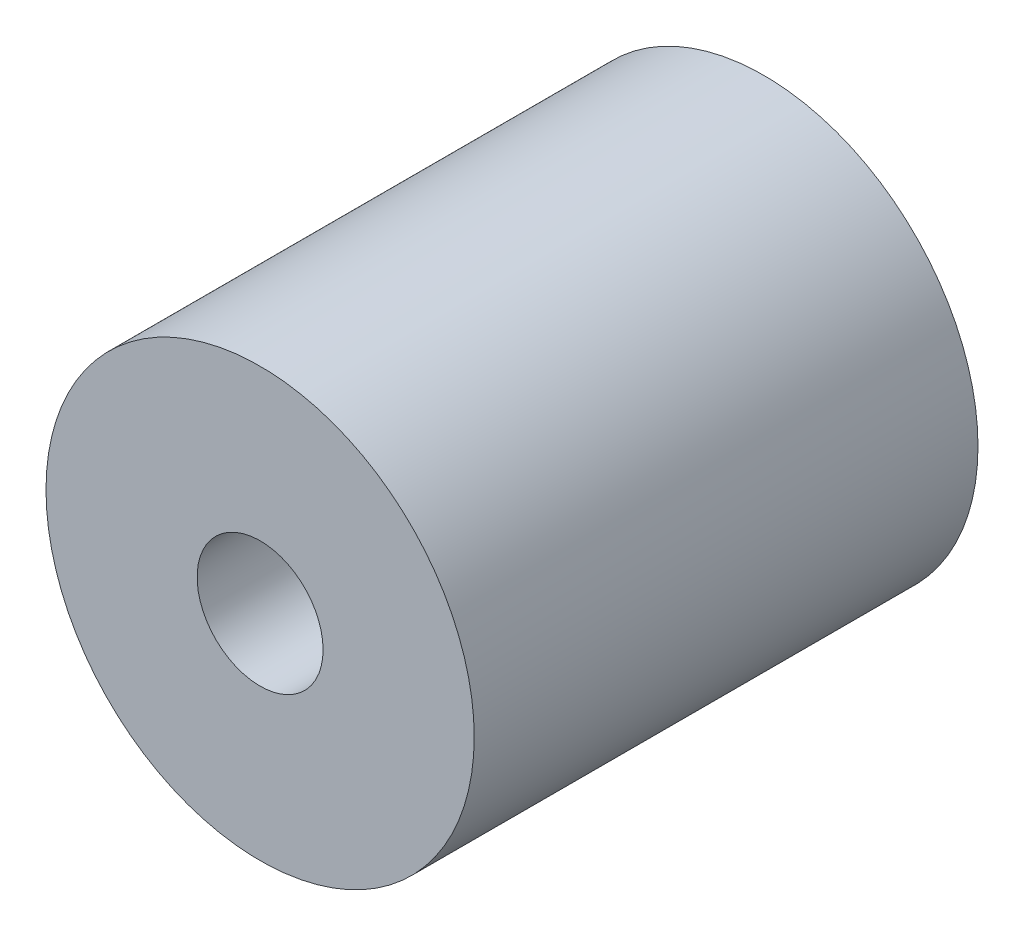
from build123d import *

# Parameters (mm, degrees)
SKETCH1_R           = 8.5
BOSS_EXTRUDE1_DEPTH = 20
SKETCH2_R           = 2.5
CUT_EXTRUDE1_DEPTH  = 24.334523779


with BuildPart() as part:
    # Sketch1 → Boss-Extrude1 (new body)
    with BuildSketch(Plane.XY):
        Circle(SKETCH1_R)
    extrude(amount=BOSS_EXTRUDE1_DEPTH)

    # Sketch2 → Cut-Extrude1 (cut, through all)
    with BuildSketch(Plane.XY.offset(20)):
        Circle(SKETCH2_R)
    extrude(amount=-CUT_EXTRUDE1_DEPTH, mode=Mode.SUBTRACT)


solid = part.part
